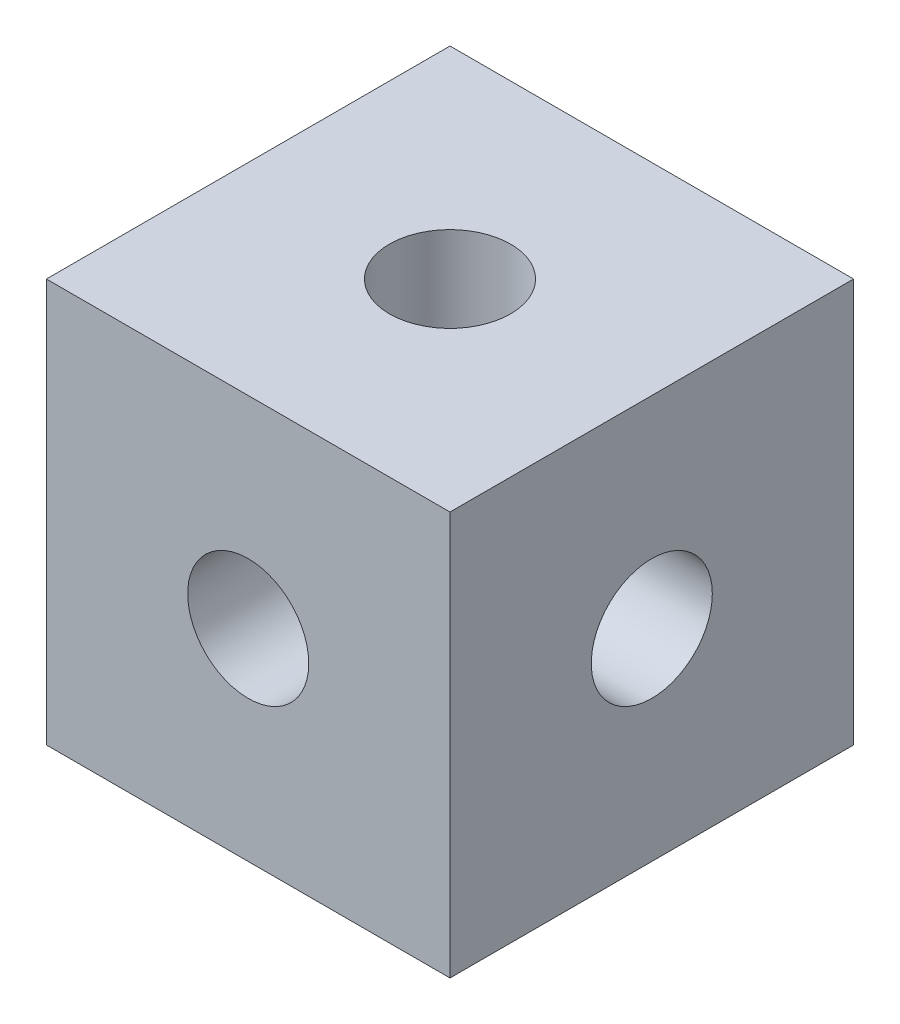
from build123d import *

# Parameters (mm, degrees)
SKETCH_1_W          = 10
SKETCH_1_H          = 10
EXTRUDE_1_DEPTH     = 10
SKETCH_2_R          = 1.5
CUT_EXTRUDE_1_DEPTH = 12
SKETCH_3_R          = 1.5
CUT_EXTRUDE_2_DEPTH = 12
SKETCH_4_R          = 1.5
CUT_EXTRUDE_3_DEPTH = 11


with BuildPart() as part:
    # 草图1 → 凸台-拉伸1 (new body)
    with BuildSketch(Plane(origin=(0, 0, 0), x_dir=(0, 0, -1), z_dir=(1, 0, 0))):
        with Locations((5, 5)):
            Rectangle(SKETCH_1_W, SKETCH_1_H)
    extrude(amount=EXTRUDE_1_DEPTH)

    # 草图2 → 切除-拉伸1 (cut)
    with BuildSketch(Plane(origin=(0, 10, 0), x_dir=(1, 0, 0), z_dir=(0, 1, 0))):
        with Locations(Location((5, 5, 0), (0, 0, 270))):
            Circle(SKETCH_2_R)
    extrude(amount=-CUT_EXTRUDE_1_DEPTH, mode=Mode.SUBTRACT)

    # 草图3 → 切除-拉伸2 (cut)
    with BuildSketch(Plane.XY):
        with Locations((5, 5)):
            Circle(SKETCH_3_R)
    extrude(amount=-CUT_EXTRUDE_2_DEPTH, mode=Mode.SUBTRACT)

    # 草图4 → 切除-拉伸3 (cut)
    with BuildSketch(Plane(origin=(10, 0, 0), x_dir=(0, 0, -1), z_dir=(1, 0, 0))):
        with Locations(Location((5, 5, 0), (0, 0, 45))):
            Circle(SKETCH_4_R)
    extrude(amount=-CUT_EXTRUDE_3_DEPTH, mode=Mode.SUBTRACT)


solid = part.part
